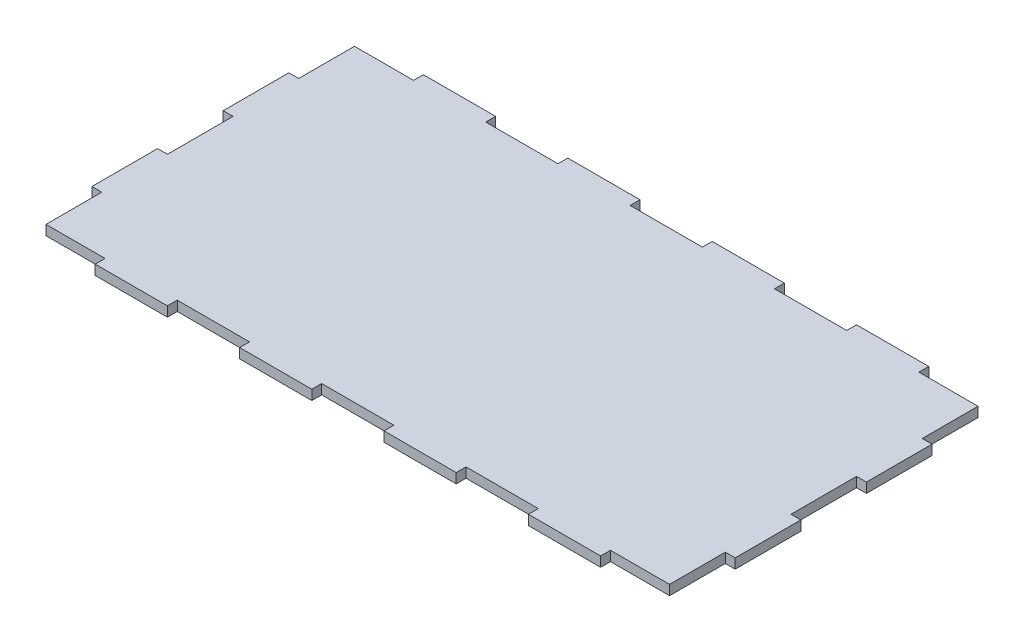
from build123d import *

# Parameters (mm, degrees)
BOSS_EXTRUDE2_DEPTH = 3


with BuildPart() as part:
    # Sketch1 → Boss-Extrude2 (new body)
    with BuildSketch(Plane(origin=(0, 0, 0), x_dir=(1, 0, 0), z_dir=(0, 1, 0))):
        Polygon((-77, -47), (-77, -50), (-55, -50), (-55, -47), (-33, -47), (-33, -50), (-11, -50), (-11, -47), (11, -47), (11, -50), (33, -50), (33, -47), (55, -47), (55, -50), (77, -50), (77, -47), (95, -47), (95, -30), (98, -30), (98, -10), (95, -10), (95, 10), (98, 10), (98, 30), (95, 30), (95, 47), (77, 47), (77, 50), (55, 50), (55, 47), (33, 47), (33, 50), (11, 50), (11, 47), (-11, 47), (-11, 50), (-33, 50), (-33, 47), (-55, 47), (-55, 50), (-77, 50), (-77, 47), (-95, 47), (-95, 30), (-98, 30), (-98, 10), (-95, 10), (-95, -10), (-98, -10), (-98, -30), (-95, -30), (-95, -47), align=None)
    extrude(amount=BOSS_EXTRUDE2_DEPTH)


solid = part.part
